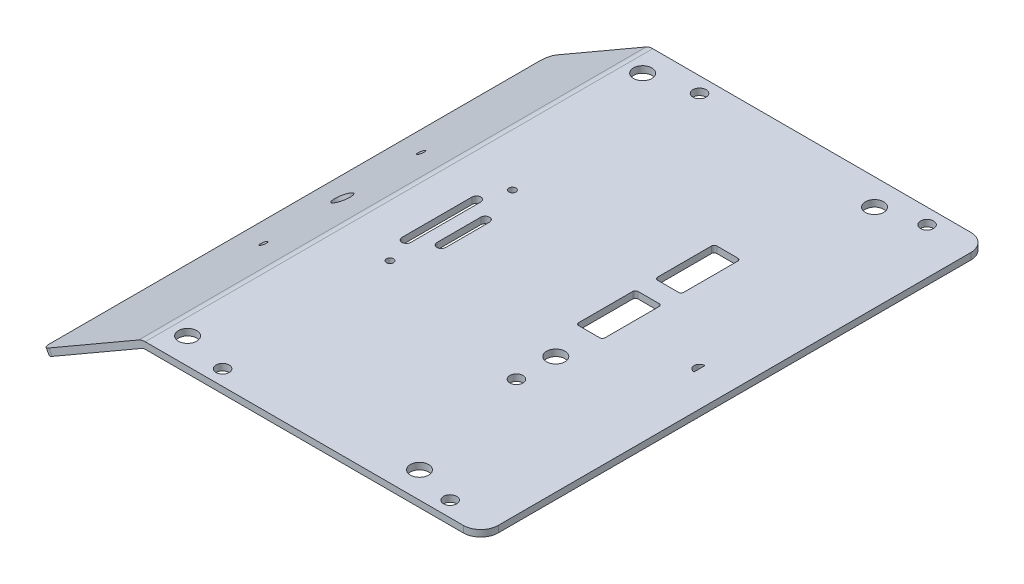
from build123d import *

# Parameters (mm, degrees)
SALIENTE_EXTRUIR1_DEPTH             = 116
CROQUIS2_W                          = 6
CROQUIS2_H                          = 13.55
CORTAR_EXTRUIR1_DEPTH               = 85.315116124
CROQUIS3_W                          = 6
CROQUIS3_H                          = 13.55
CORTAR_EXTRUIR2_DEPTH               = 85.315116124
CORTAR_EXTRUIR3_DEPTH               = 85.315116124
CORTAR_EXTRUIR4_DEPTH               = 85.069267231
DI_METRO_DE_TALADRO_2_5_2_5_1_D     = 2.5
DI_METRO_DE_TALADRO_3_0_3_1_D       = 3
DI_METRO_DE_TALADRO_1_6_1_6_1_D     = 1.6
DI_METRO_DE_TALADRO_4_0_4_1_D       = 4
DI_METRO_DE_TALADRO_4_0_4_1_DEPTH   = 12.9748366
DI_METRO_DE_TALADRO_1_6_1_6_2_D     = 1.6
DI_METRO_DE_TALADRO_1_6_1_6_2_DEPTH = 12.9748366
DI_METRO_DE_TALADRO_4_2_4_2_1_D     = 4.2
REDONDEO1_R                         = 0.6
REDONDEO2_R                         = 1.5
REDONDEO3_R                         = 2
REDONDEO4_R                         = 3
SALIENTE_EXTRUIR2_DEPTH             = 4
SALIENTE_EXTRUIR2_DEPTH_BACK        = 4
CROQUIS18_W                         = 116
CROQUIS18_H                         = 1.5
REDONDEO5_R                         = 4


with BuildPart() as part:
    # Croquis1 → Saliente-Extruir1 (new body)
    with BuildSketch(Plane(origin=(0, 0, -57), x_dir=(-1, 0, 0), z_dir=(0, 0, -1))):
        Polygon((58.4496732, -13.25), (35.5, 0), (-38, 0), (-38, -1.5), (35.098076211, -1.5), (57.6996732, -14.549038106), align=None)
    extrude(amount=-SALIENTE_EXTRUIR1_DEPTH)

    # Croquis2 → Cortar-Extruir1 (cut, through all)
    with BuildSketch(Plane(origin=(0, 0, 0), x_dir=(-1, 0, 0), z_dir=(0, 1, 0))):
        with Locations((-14.07, -18.5)):
            Rectangle(CROQUIS2_W, CROQUIS2_H)
    extrude(amount=-CORTAR_EXTRUIR1_DEPTH, mode=Mode.SUBTRACT)

    # Croquis3 → Cortar-Extruir2 (cut, through all)
    with BuildSketch(Plane(origin=(0, 0, 0), x_dir=(-1, 0, 0), z_dir=(0, 1, 0))):
        with Locations((-14.07, -0.5)):
            Rectangle(CROQUIS3_W, CROQUIS3_H)
    extrude(amount=-CORTAR_EXTRUIR2_DEPTH, mode=Mode.SUBTRACT)

    # Croquis4 → Cortar-Extruir3 (cut, through all)
    with BuildSketch(Plane(origin=(0, 0, 0), x_dir=(-1, 0, 0), z_dir=(0, 1, 0))):
        with BuildLine():
            Line((21, -4), (21, 6))
            ThreePointArc((21, 6), (20, 7), (19, 6))
            Line((19, 6), (19, -4))
            ThreePointArc((19, -4), (20, -5), (21, -4))
        make_face()
    extrude(amount=-CORTAR_EXTRUIR3_DEPTH, mode=Mode.SUBTRACT)

    # Croquis5 → Cortar-Extruir4 (cut, through all)
    with BuildSketch(Plane.XZ.offset(1.5)):
        with BuildLine():
            Line((-24, -7), (-24, 9))
            ThreePointArc((-24, 9), (-25, 10), (-26, 9))
            Line((-26, 9), (-26, -7))
            ThreePointArc((-26, -7), (-25, -8), (-24, -7))
        make_face()
    extrude(amount=-CORTAR_EXTRUIR4_DEPTH, mode=Mode.SUBTRACT)

    # Diámetro de taladro Ø2.5 (2.5)1 (through all)
    with Locations(Plane(origin=(0, -1.5, 0), x_dir=(-1, 0, 0), z_dir=(0, -1, 0))):
        with Locations((-34, -1)):
            Hole(DI_METRO_DE_TALADRO_2_5_2_5_1_D / 2)

    # Diámetro de taladro Ø3.0 (3)1 (through all)
    with Locations(Plane(origin=(0, -1.5, 0), x_dir=(-1, 0, 0), z_dir=(0, -1, 0))):
        with Locations((-15.15, -24), (-31.5, 53.5), (20.5, -55.5), (-31.5, -55.5), (20.5, 53.5)):
            Hole(DI_METRO_DE_TALADRO_3_0_3_1_D / 2)

    # Diámetro de taladro Ø1.6 (1.6)1 (through all)
    with Locations(Plane(origin=(0, -1.5, 0), x_dir=(-1, 0, 0), z_dir=(0, -1, 0))):
        with Locations((22.75, -15), (22.75, 13)):
            Hole(DI_METRO_DE_TALADRO_1_6_1_6_1_D / 2)

    # Diámetro de taladro Ø4.0 (4)1
    with Locations(Plane(origin=(-8.125, 14.072912811, 0), x_dir=(-0.8660254037844288, -0.5000000000000172, 0), z_dir=(0.5000000000000172, -0.8660254037844288, 0))):
        with Locations((44.743901834, -1)):
            Hole(DI_METRO_DE_TALADRO_4_0_4_1_D / 2, depth=DI_METRO_DE_TALADRO_4_0_4_1_DEPTH)

    # Diámetro de taladro Ø1.6 (1.6)2
    with Locations(Plane(origin=(-8.125, 14.072912811, 0), x_dir=(-0.8660254037844288, -0.5000000000000172, 0), z_dir=(0.5000000000000172, -0.8660254037844288, 0))):
        with Locations((44.743901834, -19), (44.743901834, 17)):
            Hole(DI_METRO_DE_TALADRO_1_6_1_6_2_D / 2, depth=DI_METRO_DE_TALADRO_1_6_1_6_2_DEPTH)

    # Diámetro de taladro Ø4.2 (4.2)1 (through all)
    with Locations(Plane(origin=(0, -1.5, 0), x_dir=(-1, 0, 0), z_dir=(0, -1, 0))):
        with Locations((31, -53), (31, 51), (-22, -53), (-22, 51), (-15.15, -15)):
            Hole(DI_METRO_DE_TALADRO_4_2_4_2_1_D / 2)

    # Redondeo1
    redondeo1_edges = [part.edges().sort_by_distance(p)[0] for p in [
        (17.07, -0.75, -25.275),
        (17.07, -0.75, -11.725),
        (11.07, -0.75, -11.725),
        (11.07, -0.75, -25.275),
        (11.07, -0.75, -7.275),
        (17.07, -0.75, -7.275),
        (17.07, -0.75, 6.275),
        (11.07, -0.75, 6.275),
    ]]
    fillet(redondeo1_edges, radius=REDONDEO1_R)

    # Redondeo2
    redondeo2_edges = [part.edges().sort_by_distance(p)[0] for p in [
        (-35.098076211, -1.5, 1),
    ]]
    fillet(redondeo2_edges, radius=REDONDEO2_R)

    # Redondeo3
    redondeo3_edges = [part.edges().sort_by_distance(p)[0] for p in [
        (38, -0.75, 59),
        (-58.0746732, -13.899519053, 59),
        (38, -0.75, -57),
        (-58.0746732, -13.899519053, -57),
    ]]
    fillet(redondeo3_edges, radius=REDONDEO3_R)

    # Redondeo4
    redondeo4_edges = [part.edges().sort_by_distance(p)[0] for p in [
        (-35.5, 0, 1),
    ]]
    fillet(redondeo4_edges, radius=REDONDEO4_R)

    # Croquis18 → Saliente-Extruir2 (add, two sides: drawn at the far end of the back side and taken through both)
    with BuildSketch(Plane(origin=(38, 0, 0), x_dir=(0, 0, -1), z_dir=(1, 0, 0)).offset(-SALIENTE_EXTRUIR2_DEPTH_BACK)):
        with Locations((-1, -0.75)):
            Rectangle(CROQUIS18_W, CROQUIS18_H)
    extrude(amount=SALIENTE_EXTRUIR2_DEPTH + SALIENTE_EXTRUIR2_DEPTH_BACK)

    # Redondeo5
    redondeo5_edges = [part.edges().sort_by_distance(p)[0] for p in [
        (42, -0.75, 59),
        (42, -0.75, -57),
    ]]
    fillet(redondeo5_edges, radius=REDONDEO5_R)


solid = part.part
